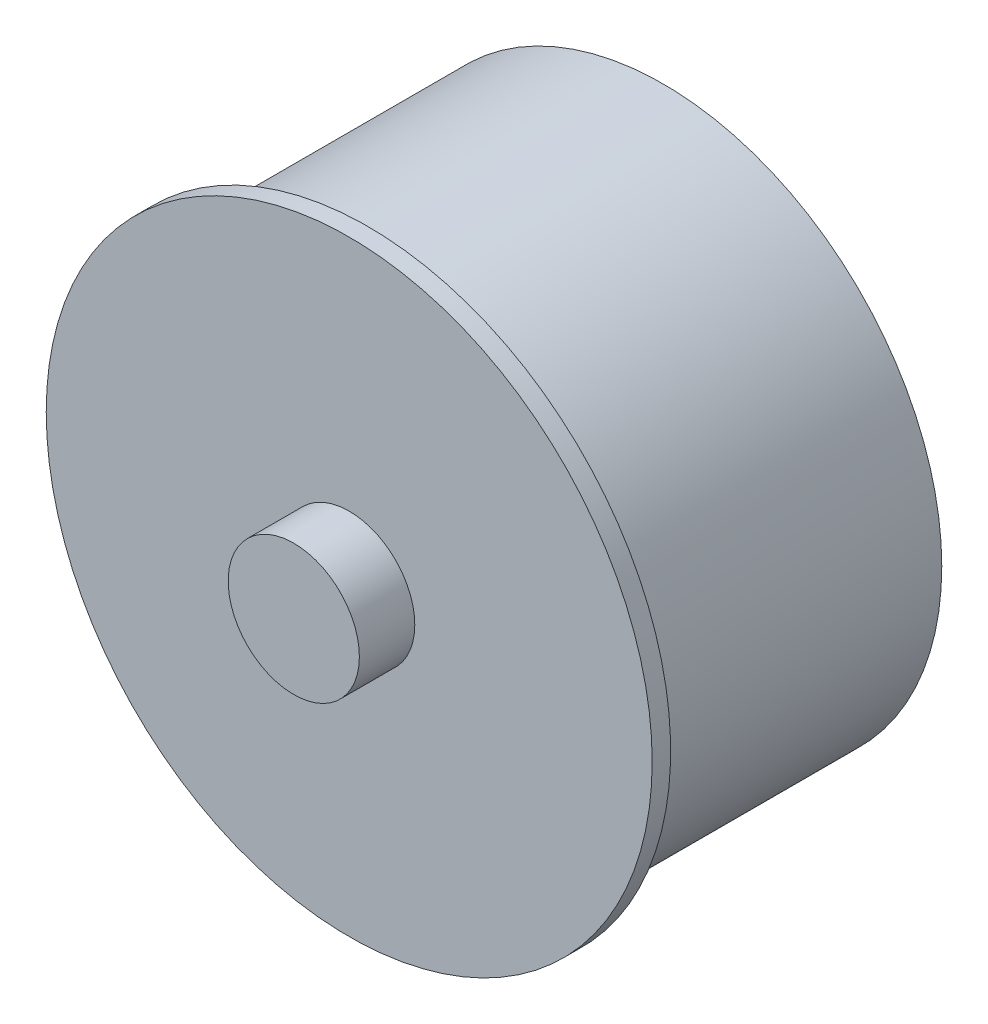
from build123d import *

# Parameters (mm, degrees)
SKETCH_1_R          = 16.4
EXTRUDE_1_DEPTH     = 17
SKETCH_2_R          = 3.55
EXTRUDE_2_DEPTH     = 3
SKETCH_3_R          = 10.075
EXTRUDE_3_DEPTH     = 2
SKETCH_7_R          = 1.05
CUT_EXTRUDE_3_DEPTH = 10
SKETCH3_R           = 16.4
SKETCH3_R_2         = 15.075
CUT_EXTRUDE1_DEPTH  = 16


with BuildPart() as part:
    # 草图1 → 凸台-拉伸1 (new body)
    with BuildSketch(Plane.XY):
        Circle(SKETCH_1_R)
    extrude(amount=EXTRUDE_1_DEPTH)

    # 草图2 → 凸台-拉伸2 (add)
    with BuildSketch(Plane.XY.offset(17)):
        Circle(SKETCH_2_R)
    extrude(amount=EXTRUDE_2_DEPTH)


with BuildPart() as body_2:
    # 草图3 → 凸台-拉伸3 (new body)
    with BuildSketch(Plane(origin=(0, 0, 0), x_dir=(-1, 0, 0), z_dir=(0, 0, -1))):
        Circle(SKETCH_3_R)
    extrude(amount=EXTRUDE_3_DEPTH)


with BuildPart() as cut_extrude_3_tool:
    # 草图7 → 切除-拉伸3 (new body)
    with BuildSketch(Plane(origin=(0, 0, -2), x_dir=(-1, 0, 0), z_dir=(0, 0, -1))):
        with Locations((0, 8)):
            Circle(SKETCH_7_R)
        with Locations((8, 0)):
            Circle(SKETCH_7_R)
        with Locations((0, -8)):
            Circle(SKETCH_7_R)
        with Locations((-8, 0)):
            Circle(SKETCH_7_R)
    extrude(amount=-CUT_EXTRUDE_3_DEPTH)


with BuildPart() as part_1:
    add(part.part)

    # 切除-拉伸3: cut by cut_extrude_3_tool
    add(cut_extrude_3_tool.part, mode=Mode.SUBTRACT)

    # Sketch3 → Cut-Extrude1 (cut)
    with BuildSketch(Plane(origin=(0, 0, 0), x_dir=(-1, 0, 0), z_dir=(0, 0, -1))):
        Circle(SKETCH3_R)
        Circle(SKETCH3_R_2, mode=Mode.SUBTRACT)
    extrude(amount=-CUT_EXTRUDE1_DEPTH, mode=Mode.SUBTRACT)


with BuildPart() as body_2_1:
    add(body_2.part)

    # 切除-拉伸3: cut by cut_extrude_3_tool
    add(cut_extrude_3_tool.part, mode=Mode.SUBTRACT)


solid = Compound([part_1.part, body_2_1.part])
